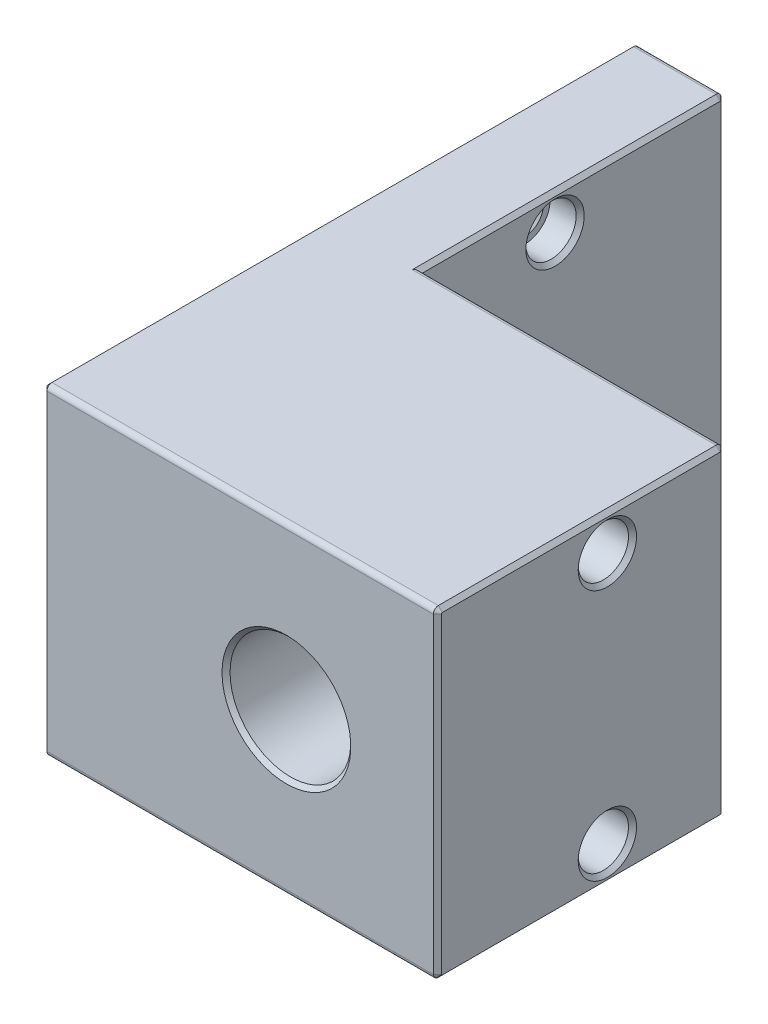
from build123d import *

# Parameters (mm, degrees)
SKETCH1_W           = 32
SKETCH1_H           = 28.6
SKETCH1_R           = 2.5
SKETCH1_H_2         = 30.2
SKETCH1_R_2         = 1.45
BOSS_EXTRUDE1_DEPTH = 6
BOSS_EXTRUDE2_START = 3
SKETCH1_4_W         = 32
SKETCH1_4_H         = 28.6
SKETCH1_4_R         = 2.5
SKETCH1_4_H_2       = 30.2
SKETCH1_4_R_2       = 1.45
BOSS_EXTRUDE2_DEPTH = 3
BOSS_EXTRUDE3_START = 3
SKETCH1_5_W         = 32
SKETCH1_5_H         = 28.6
SKETCH1_5_R         = 2.5
SKETCH1_5_R_2       = 1.45
BOSS_EXTRUDE3_DEPTH = 30.2
CUT_EXTRUDE1_DEPTH  = 48.647455336
CUT_EXTRUDE2_START  = -18
CUT_EXTRUDE2_DEPTH  = 30.647455336
CUT_EXTRUDE3_START  = 26
SKETCH1_6_R         = 2.5
SKETCH1_6_R_2       = 1.45
CUT_EXTRUDE3_DEPTH  = 7.2
FILLET1_R           = 0.5
CHAMFER1_SIZE       = 0.4


with BuildPart() as part:
    # Sketch1 → Boss-Extrude1 (new body)
    # profile 1 of 6: a face of its own
    with BuildSketch(Plane.YZ):
        with Locations((0, 15.1)):
            Rectangle(SKETCH1_W, SKETCH1_H)
        with Locations((-12.5, 12.5)):
            Circle(SKETCH1_R, mode=Mode.SUBTRACT)
        with Locations((12.5, 12.5)):
            Circle(SKETCH1_R, mode=Mode.SUBTRACT)
    # profile 2 of 6: a face of its own
    with BuildSketch(Plane.YZ):
        with Locations((0, -14.3)):
            Rectangle(SKETCH1_W, SKETCH1_H_2)
        with Locations((-12.5, -12.5)):
            Circle(SKETCH1_R, mode=Mode.SUBTRACT)
        with Locations((12.5, -12.5)):
            Circle(SKETCH1_R, mode=Mode.SUBTRACT)
    # profile 3 of 6: a face of its own
    with BuildSketch(Plane.YZ):
        with Locations((-12.5, 12.5)):
            Circle(SKETCH1_R)
        with Locations(Location((-12.5, 12.5, 0), (0, 0, 270))):
            Circle(SKETCH1_R_2, mode=Mode.SUBTRACT)
    # profile 4 of 6: a face of its own
    with BuildSketch(Plane.YZ):
        with Locations((12.5, 12.5)):
            Circle(SKETCH1_R)
        with Locations(Location((12.5, 12.5, 0), (0, 0, 270))):
            Circle(SKETCH1_R_2, mode=Mode.SUBTRACT)
    # profile 5 of 6: a face of its own
    with BuildSketch(Plane.YZ):
        with Locations((12.5, -12.5)):
            Circle(SKETCH1_R)
        with Locations(Location((12.5, -12.5, 0), (0, 0, 270))):
            Circle(SKETCH1_R_2, mode=Mode.SUBTRACT)
    # profile 6 of 6: a face of its own
    with BuildSketch(Plane.YZ):
        with Locations((-12.5, -12.5)):
            Circle(SKETCH1_R)
        with Locations(Location((-12.5, -12.5, 0), (0, 0, 270))):
            Circle(SKETCH1_R_2, mode=Mode.SUBTRACT)
    extrude(amount=-BOSS_EXTRUDE1_DEPTH)

    # Sketch1<4> → Boss-Extrude2 (add)
    # profile 1 of 4: a face of its own
    with BuildSketch(Plane.YZ.offset(BOSS_EXTRUDE2_START)):
        with Locations((0, 15.1)):
            Rectangle(SKETCH1_4_W, SKETCH1_4_H)
        with Locations((-12.5, 12.5)):
            Circle(SKETCH1_4_R, mode=Mode.SUBTRACT)
        with Locations((12.5, 12.5)):
            Circle(SKETCH1_4_R, mode=Mode.SUBTRACT)
    # profile 2 of 4: a face of its own
    with BuildSketch(Plane.YZ.offset(BOSS_EXTRUDE2_START)):
        with Locations((0, -14.3)):
            Rectangle(SKETCH1_4_W, SKETCH1_4_H_2)
        with Locations(Location((-12.5, -12.5, 0), (0, 0, 270))):
            Circle(SKETCH1_4_R, mode=Mode.SUBTRACT)
        with Locations(Location((12.5, -12.5, 0), (0, 0, 270))):
            Circle(SKETCH1_4_R, mode=Mode.SUBTRACT)
    # profile 3 of 4: a face of its own
    with BuildSketch(Plane.YZ.offset(BOSS_EXTRUDE2_START)):
        with Locations((12.5, 12.5)):
            Circle(SKETCH1_4_R)
        with Locations(Location((12.5, 12.5, 0), (0, 0, 270))):
            Circle(SKETCH1_4_R_2, mode=Mode.SUBTRACT)
    # profile 4 of 4: a face of its own
    with BuildSketch(Plane.YZ.offset(BOSS_EXTRUDE2_START)):
        with Locations((-12.5, 12.5)):
            Circle(SKETCH1_4_R)
        with Locations(Location((-12.5, 12.5, 0), (0, 0, 270))):
            Circle(SKETCH1_4_R_2, mode=Mode.SUBTRACT)
    extrude(amount=-BOSS_EXTRUDE2_DEPTH)

    # Sketch1<5> → Boss-Extrude3 (add)
    # profile 1 of 3: a face of its own
    with BuildSketch(Plane.YZ.offset(BOSS_EXTRUDE3_START)):
        with Locations((0, 15.1)):
            Rectangle(SKETCH1_5_W, SKETCH1_5_H)
        with Locations((-12.5, 12.5)):
            Circle(SKETCH1_5_R, mode=Mode.SUBTRACT)
        with Locations((12.5, 12.5)):
            Circle(SKETCH1_5_R, mode=Mode.SUBTRACT)
    # profile 2 of 3: a face of its own
    with BuildSketch(Plane.YZ.offset(BOSS_EXTRUDE3_START)):
        with Locations((-12.5, 12.5)):
            Circle(SKETCH1_5_R)
        with Locations(Location((-12.5, 12.5, 0), (0, 0, 270))):
            Circle(SKETCH1_5_R_2, mode=Mode.SUBTRACT)
    # profile 3 of 3: a face of its own
    with BuildSketch(Plane.YZ.offset(BOSS_EXTRUDE3_START)):
        with Locations((12.5, 12.5)):
            Circle(SKETCH1_5_R)
        with Locations(Location((12.5, 12.5, 0), (0, 0, 270))):
            Circle(SKETCH1_5_R_2, mode=Mode.SUBTRACT)
    extrude(amount=BOSS_EXTRUDE3_DEPTH)

    # Sketch2 → Cut-Extrude1 (cut, through all)
    with BuildSketch(Plane(origin=(0, 0, 0.8), x_dir=(1, 0, 0), z_dir=(0, 0, -1))):
        with BuildLine():
            ThreePointArc((21.4, 0), (20.4627417, 2.2627417), (18.2, 3.2))
            Line((18.2, 3.2), (18.2, -3.2))
            ThreePointArc((18.2, -3.2), (20.4627417, -2.2627417), (21.4, 0))
        make_face()
        with BuildLine():
            Line((18.2, -3.2), (18.2, 3.2))
            ThreePointArc((18.2, 3.2), (15, 0), (18.2, -3.2))
        make_face()
    extrude(amount=-CUT_EXTRUDE1_DEPTH, mode=Mode.SUBTRACT)

    # Sketch2<3> → Cut-Extrude2 (cut, through all)
    with BuildSketch(Plane(origin=(0, 0, 0.8), x_dir=(1, 0, 0), z_dir=(0, 0, -1)).offset(CUT_EXTRUDE2_START)):
        with BuildLine():
            ThreePointArc((24.2, 0), (22.442640687, 4.242640687), (18.2, 6))
            Line((18.2, 6), (18.2, 3.2))
            ThreePointArc((18.2, 3.2), (20.4627417, 2.2627417), (21.4, 0))
            ThreePointArc((21.4, 0), (20.4627417, -2.2627417), (18.2, -3.2))
            Line((18.2, -3.2), (18.2, -6))
            ThreePointArc((18.2, -6), (22.442640687, -4.242640687), (24.2, 0))
        make_face()
        with BuildLine():
            Line((18.2, 3.2), (18.2, 6))
            ThreePointArc((18.2, 6), (12.2, 0), (18.2, -6))
            Line((18.2, -6), (18.2, -3.2))
            ThreePointArc((18.2, -3.2), (15, 0), (18.2, 3.2))
        make_face()
    extrude(amount=-CUT_EXTRUDE2_DEPTH, mode=Mode.SUBTRACT)

    # Sketch1<6> → Cut-Extrude3 (cut)
    # profile 1 of 2: a face of its own
    with BuildSketch(Plane.YZ.offset(CUT_EXTRUDE3_START)):
        with Locations(Location((-12.5, 12.5, 0), (0, 0, 90))):
            Circle(SKETCH1_6_R)
        with Locations(Location((-12.5, 12.5, 0), (0, 0, 270))):
            Circle(SKETCH1_6_R_2, mode=Mode.SUBTRACT)
    # profile 2 of 2: a face of its own
    with BuildSketch(Plane.YZ.offset(CUT_EXTRUDE3_START)):
        with Locations(Location((12.5, 12.5, 0), (0, 0, 90))):
            Circle(SKETCH1_6_R)
        with Locations(Location((12.5, 12.5, 0), (0, 0, 270))):
            Circle(SKETCH1_6_R_2, mode=Mode.SUBTRACT)
    extrude(amount=CUT_EXTRUDE3_DEPTH, mode=Mode.SUBTRACT)

    # Fillet1
    fillet1_edges = [part.edges().sort_by_distance(p)[0] for p in [
        (13.6, -16, 29.4),
        (13.6, 16, 29.4),
        (-1.5, 16, -29.4),
        (-1.5, -16, -29.4),
        (18.1, -16, 0.8),
        (18.1, 16, 0.8),
    ]]
    fillet(fillet1_edges, radius=FILLET1_R)

    # Chamfer1
    chamfer1_edges = [part.edges().sort_by_distance(p)[0] for p in [
        (3, 16, -13.8),
        (-6, 16, 0),
        (33.2, -16, 15.1),
        (33.2, 0, 0.8),
        (0, -12.5, -11.05),
        (33.2, 0, 29.4),
        (33.2, -15.853553391, 0.946446609),
        (33.2, 15.853553391, 0.946446609),
        (33.2, -15.853553391, 29.253553391),
        (33.2, 15.853553391, 29.253553391),
        (-6, 0, 29.4),
        (0, 12.5, -11.05),
        (-6, -16, 0),
        (-6, 0, -29.4),
        (-6, -15.853553391, -29.253553391),
        (-6, 15.853553391, -29.253553391),
        (-6, -15.853553391, 29.253553391),
        (-6, 15.853553391, 29.253553391),
        (3, -16, -13.8),
        (3, 0, -29.4),
        (3, -15.853553391, -29.253553391),
        (3, 15.853553391, -29.253553391),
        (-6, -12.5, 13.95),
        (3, 12.5, -10),
        (3, -12.5, -10),
        (-6, 12.5, 13.95),
        (-6, 12.5, -11.05),
        (-6, -12.5, -11.05),
        (18.2, 3.2, 0.8),
        (18.2, 3.2, 18.8),
        (18.2, 6, 29.4),
        (33.2, -12.5, 10),
        (26, -12.5, 13.95),
        (33.2, 12.5, 10),
        (26, 12.5, 13.95),
        (33.2, 16, 15.1),
    ]]
    chamfer(chamfer1_edges, length=CHAMFER1_SIZE)


solid = part.part
